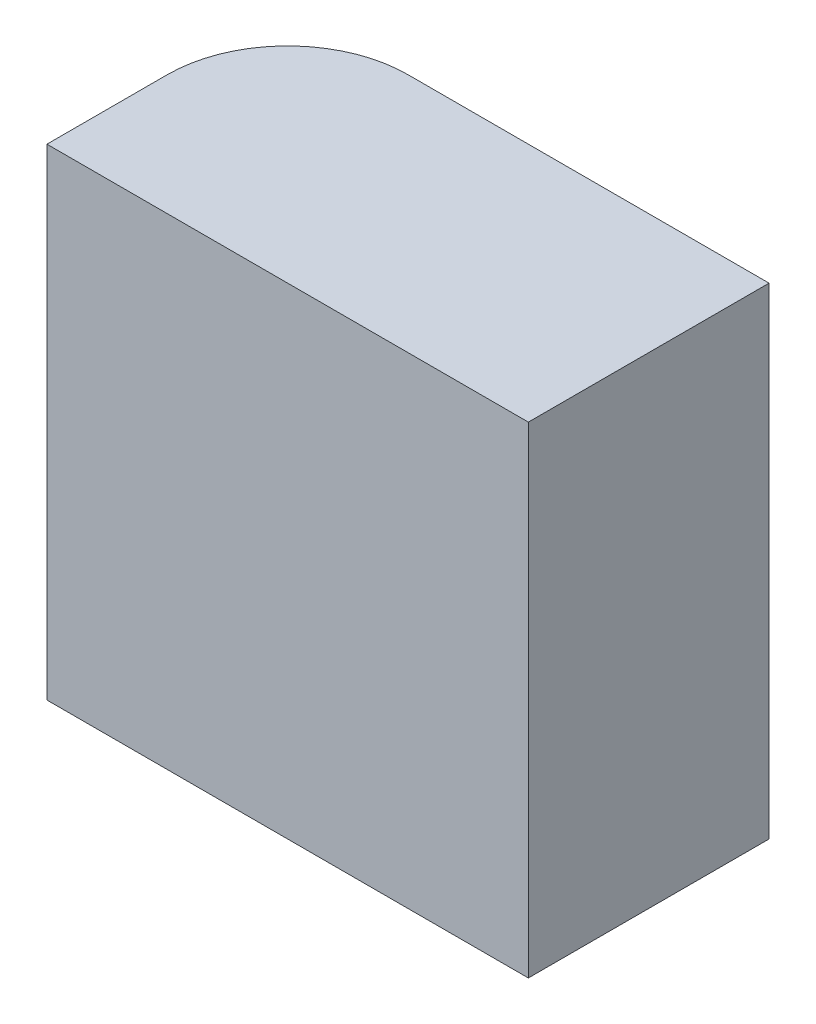
from build123d import *

# Parameters (mm, degrees)
BOSS_EXTRUDE1_DEPTH = 20


with BuildPart() as part:
    # Sketch1 → Boss-Extrude1 (new body)
    with BuildSketch(Plane(origin=(0, 0, 0), x_dir=(1, 0, 0), z_dir=(0, 1, 0))):
        with BuildLine():
            Line((0, 0), (15, 0))
            Line((15, 0), (15, -10))
            Line((15, -10), (-5, -10))
            Line((-5, -10), (-5, -5))
            ThreePointArc((-5, -5), (-3.535533906, -1.464466094), (0, 0))
        make_face()
    extrude(amount=BOSS_EXTRUDE1_DEPTH)


solid = part.part
